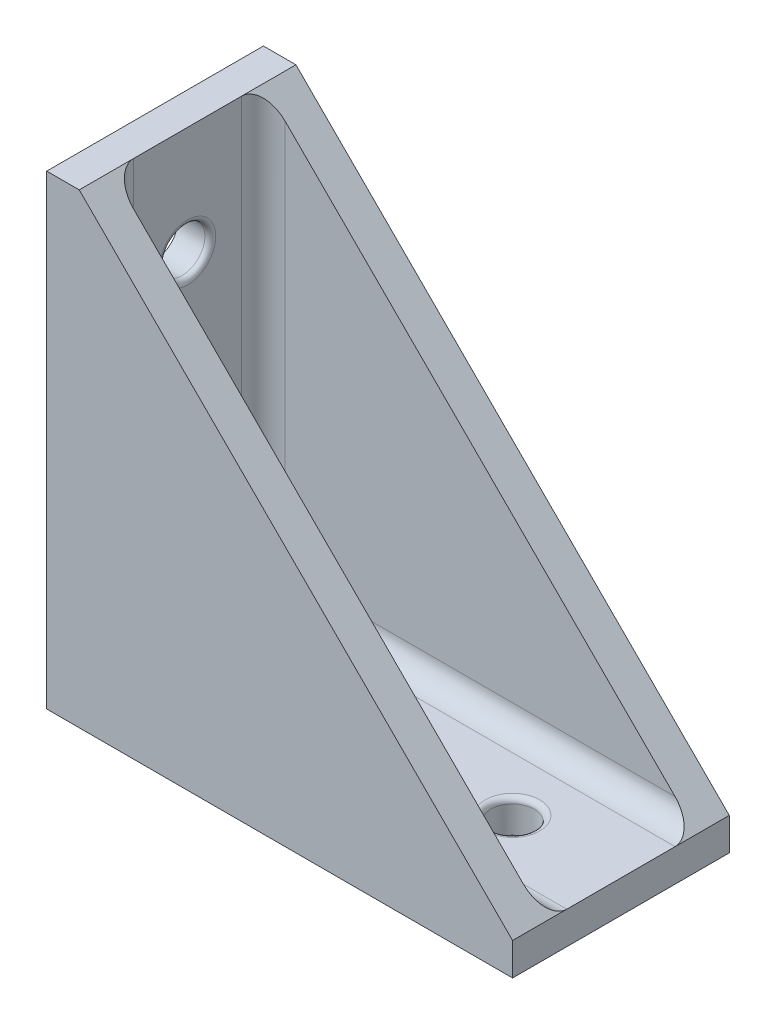
from build123d import *

# Parameters (mm, degrees)
BOSS_EXTRUDE1_DEPTH = 20
BOSS_EXTRUDE2_DEPTH = 3
BOSS_EXTRUDE3_DEPTH = 3
SKETCH4_R           = 2.1
CUT_EXTRUDE1_DEPTH  = 63.040309477
SKETCH5_R           = 2
CUT_EXTRUDE2_DEPTH  = 3
FILLET3_R           = 2
FILLET4_R           = 0.5


with BuildPart() as part:
    # Sketch1 → Boss-Extrude1 (new body)
    with BuildSketch(Plane.XY):
        Polygon((0, 0), (0, 43), (3, 43), (3, 3), (43, 3), (43, 0), align=None)
    extrude(amount=BOSS_EXTRUDE1_DEPTH)

    # Sketch2 → Boss-Extrude2 (add)
    with BuildSketch(Plane.XY.offset(20)):
        Polygon((3, 43), (43, 3), (3, 3), align=None)
    extrude(amount=-BOSS_EXTRUDE2_DEPTH)

    # Sketch3 → Boss-Extrude3 (add)
    with BuildSketch(Plane(origin=(0, 0, 0), x_dir=(-1, 0, 0), z_dir=(0, 0, -1))):
        Polygon((-3, 43), (-43, 3), (-3, 3), align=None)
    extrude(amount=-BOSS_EXTRUDE3_DEPTH)

    # Sketch4 → Cut-Extrude1 (cut, through all)
    with BuildSketch(Plane(origin=(3, 0, 0), x_dir=(0, 0, -1), z_dir=(1, 0, 0))):
        with Locations(Location((-10, 33, 0), (0, 0, 90))):
            Circle(SKETCH4_R)
        with Locations(Location((-10, 13, 0), (0, 0, 90))):
            Circle(SKETCH4_R)
    extrude(amount=-CUT_EXTRUDE1_DEPTH, mode=Mode.SUBTRACT)

    # Sketch5 → Cut-Extrude2 (cut)
    with BuildSketch(Plane(origin=(0, 3, 0), x_dir=(1, 0, 0), z_dir=(0, 1, 0))):
        with Locations(Location((13, -10, 0), (0, 0, 270))):
            Circle(SKETCH5_R)
        with Locations(Location((33, -10, 0), (0, 0, 270))):
            Circle(SKETCH5_R)
    extrude(amount=-CUT_EXTRUDE2_DEPTH, mode=Mode.SUBTRACT)

    # Fillet3
    fillet3_edges = [part.edges().sort_by_distance(p)[0] for p in [
        (3, 3, 10),
        (3, 23, 17),
        (23, 3, 17),
        (3, 23, 3),
        (23, 3, 3),
    ]]
    fillet(fillet3_edges, radius=FILLET3_R)

    # Fillet4
    fillet4_edges = [part.edges().sort_by_distance(p)[0] for p in [
        (3, 30.9, 10),
        (3, 10.9, 10),
        (13, 3, 8),
        (33, 3, 8),
    ]]
    fillet(fillet4_edges, radius=FILLET4_R)


solid = part.part
